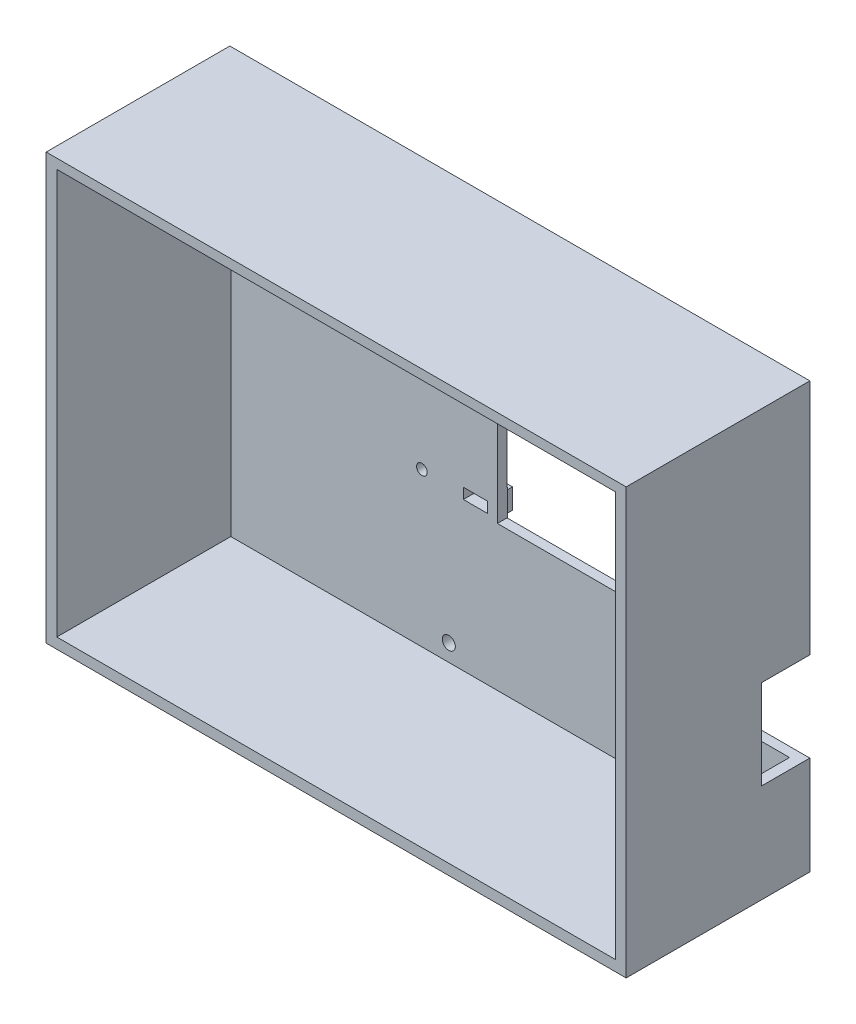
from build123d import *

# Parameters (mm, degrees)
SKETCH_1_W          = 120
SKETCH_1_H          = 80
EXTRUDE_1_DEPTH     = 38
SKETCH_3_W          = 117.6
SKETCH_3_H          = 77.6
CUT_EXTRUDE_1_DEPTH = 36
SKETCH_4_W          = 25.152970524
SKETCH_4_H          = 18.492901276
CUT_EXTRUDE_2_DEPTH = 10
SKETCH_7_W          = 17.413678367
SKETCH_7_H          = 5.076618726
SKETCH_7_H_2        = 5.541721388
EXTRUDE_2_DEPTH     = 0.1
SKETCH_9_W          = 27.882777132
SKETCH_9_H          = 24.878568111
CUT_EXTRUDE_4_DEPTH = 12
SKETCH_12_R         = 1.085209003
SKETCH_12_R_2       = 1.1
SKETCH_12_W         = 5.025
SKETCH_12_H         = 2.2
CUT_EXTRUDE_5_DEPTH = 12
SKETCH_13_R         = 1.35
CUT_EXTRUDE_6_DEPTH = 12
SKETCH_14_W         = 117.6
SKETCH_14_H         = 36
CUT_EXTRUDE_7_DEPTH = 10
EXTRUDE_3_DEPTH     = 5
SKETCH_16_W         = 120
SKETCH_16_H         = 38
EXTRUDE_4_DEPTH     = 2
SKETCH_17_W         = 36
SKETCH_17_H         = 83.8
EXTRUDE_5_DEPTH     = 1
EXTRUDE_6_DEPTH     = 1
SKETCH_19_W         = 120
SKETCH_19_H         = 38
EXTRUDE_7_DEPTH     = 1
EXTRUDE_START       = 2
SKETCH_20_R         = 2
SKETCH_20_R_2       = 1.085209003
SKETCH_20_R_3       = 2.001649737
SKETCH_20_R_4       = 1.1
SKETCH_20_W         = 7.2
SKETCH_20_H         = 4.2
SKETCH_20_W_2       = 5.025
SKETCH_20_H_2       = 2.2
EXTRUDE_8_DEPTH     = 2


with BuildPart() as part:
    # 草图1 → 凸台-拉伸1 (new body)
    with BuildSketch(Plane.XY):
        with Locations((-463.106796117, 303.186737633)):
            Rectangle(SKETCH_1_W, SKETCH_1_H)
    extrude(amount=EXTRUDE_1_DEPTH)

    # 草图3 → 切除-拉伸1 (cut)
    with BuildSketch(Plane.XY.offset(38)):
        with Locations((-463.106796117, 303.186737633)):
            Rectangle(SKETCH_3_W, SKETCH_3_H)
    extrude(amount=-CUT_EXTRUDE_1_DEPTH, mode=Mode.SUBTRACT)

    # 草图4 → 切除-拉伸2 (cut)
    with BuildSketch(Plane(origin=(0, 0, 0), x_dir=(-1, 0, 0), z_dir=(0, 0, -1))):
        with Locations((411.924701676, 291.841861287)):
            Rectangle(SKETCH_4_W, SKETCH_4_H)
    extrude(amount=-CUT_EXTRUDE_2_DEPTH, mode=Mode.SUBTRACT)

    # 草图7 → 凸台-拉伸2 (add)
    with BuildSketch(Plane(origin=(0, 0, 0), x_dir=(-1, 0, 0), z_dir=(0, 0, -1))):
        with Locations((474.461956934, 316.64842827)):
            Rectangle(SKETCH_7_W, SKETCH_7_H)
        with Locations((474.461956934, 296.957598327)):
            Rectangle(SKETCH_7_W, SKETCH_7_H_2)
    extrude(amount=EXTRUDE_2_DEPTH)

    # 草图9 → 切除-拉伸4 (cut)
    with BuildSketch(Plane(origin=(0, 0, 0), x_dir=(-1, 0, 0), z_dir=(0, 0, -1))):
        with Locations((451.813729184, 306.747453577)):
            Rectangle(SKETCH_9_W, SKETCH_9_H)
    extrude(amount=-CUT_EXTRUDE_4_DEPTH, mode=Mode.SUBTRACT)

    # 草图12 → 切除-拉伸5 (cut)
    with BuildSketch(Plane(origin=(0, 0, -0.1), x_dir=(-1, 0, 0), z_dir=(0, 0, -1))):
        with Locations((481.368796117, 317.386737633)):
            Circle(SKETCH_12_R)
        with Locations((481.368796117, 296.186737633)):
            Circle(SKETCH_12_R_2)
        with Locations((470.281296117, 317.386737633)):
            Rectangle(SKETCH_12_W, SKETCH_12_H)
        with Locations((470.281296117, 296.186737633)):
            Rectangle(SKETCH_12_W, SKETCH_12_H)
    extrude(amount=-CUT_EXTRUDE_5_DEPTH, mode=Mode.SUBTRACT)

    # 草图13 → 切除-拉伸6 (cut)
    with BuildSketch(Plane.XY.offset(2)):
        with Locations((-475.806796117, 316.886737633)):
            Circle(SKETCH_13_R)
        with Locations((-417.806796117, 316.886737633)):
            Circle(SKETCH_13_R)
        with Locations((-417.806796117, 267.886737633)):
            Circle(SKETCH_13_R)
        with Locations((-475.806796117, 267.886737633)):
            Circle(SKETCH_13_R)
    extrude(amount=-CUT_EXTRUDE_6_DEPTH, mode=Mode.SUBTRACT)

    # 草图14 → 切除-拉伸7 (cut)
    with BuildSketch(Plane.XZ.offset(-341.986737633)):
        with Locations((-463.106796117, 20)):
            Rectangle(SKETCH_14_W, SKETCH_14_H)
    extrude(amount=-CUT_EXTRUDE_7_DEPTH, mode=Mode.SUBTRACT)

    # 草图15 → 凸台-拉伸3 (add)
    with BuildSketch(Plane(origin=(0, 343.186737633, 0), x_dir=(1, 0, 0), z_dir=(0, 1, 0))):
        Polygon((-521.906796117, -2), (-404.306796117, -2), (-404.306796117, -38), (-403.106796117, -38), (-403.106796117, 0), (-523.106796117, 0), (-523.106796117, -38), (-521.906796117, -38), align=None)
    extrude(amount=EXTRUDE_3_DEPTH)

    # 草图16 → 凸台-拉伸4 (add)
    with BuildSketch(Plane(origin=(0, 348.186737633, 0), x_dir=(1, 0, 0), z_dir=(0, 1, 0))):
        with Locations((-463.106796117, -19)):
            Rectangle(SKETCH_16_W, SKETCH_16_H)
    extrude(amount=EXTRUDE_4_DEPTH)

    # 草图17 → 凸台-拉伸5 (add)
    with BuildSketch(Plane(origin=(-521.906796117, 0, 0), x_dir=(0, 0, -1), z_dir=(1, 0, 0))):
        with Locations((-20, 306.286737633)):
            Rectangle(SKETCH_17_W, SKETCH_17_H)
    extrude(amount=EXTRUDE_5_DEPTH)

    # 草图18 → 凸台-拉伸6 (add)
    with BuildSketch(Plane.ZY.offset(404.306796117)):
        Polygon((10, 301.088311925), (10, 282.595410649), (2, 282.595410649), (2, 264.386737633), (38, 264.386737633), (38, 348.186737633), (2, 348.186737633), (2, 301.088311925), align=None)
    extrude(amount=EXTRUDE_6_DEPTH)

    # 草图19 → 凸台-拉伸7 (add)
    with BuildSketch(Plane.XZ.offset(-263.186737633)):
        with Locations((-463.106796117, 19)):
            Rectangle(SKETCH_19_W, SKETCH_19_H)
    extrude(amount=EXTRUDE_7_DEPTH)

    # 草图20 → 凸台-拉伸8 (add)
    # profile 1 of 4: a face of its own
    with BuildSketch(Plane(origin=(0, 0, -0.1), x_dir=(-1, 0, 0), z_dir=(0, 0, -1)).offset(EXTRUDE_START)):
        with Locations(Location((481.368796117, 317.386737633, 0), (0, 0, 115.841932763))):
            Circle(SKETCH_20_R)
        with Locations((481.368796117, 317.386737633)):
            Circle(SKETCH_20_R_2, mode=Mode.SUBTRACT)
    # profile 2 of 4: a face of its own
    with BuildSketch(Plane(origin=(0, 0, -0.1), x_dir=(-1, 0, 0), z_dir=(0, 0, -1)).offset(EXTRUDE_START)):
        with Locations(Location((481.368796117, 296.186737633, 0), (0, 0, 267.673619076))):
            Circle(SKETCH_20_R_3)
        with Locations((481.368796117, 296.186737633)):
            Circle(SKETCH_20_R_4, mode=Mode.SUBTRACT)
    # profile 3 of 4: a face of its own
    with BuildSketch(Plane(origin=(0, 0, -0.1), x_dir=(-1, 0, 0), z_dir=(0, 0, -1)).offset(EXTRUDE_START)):
        with Locations((470.395177276, 317.386737633)):
            Rectangle(SKETCH_20_W, SKETCH_20_H)
        with Locations((470.281296117, 317.386737633)):
            Rectangle(SKETCH_20_W_2, SKETCH_20_H_2, mode=Mode.SUBTRACT)
    # profile 4 of 4: a face of its own
    with BuildSketch(Plane(origin=(0, 0, -0.1), x_dir=(-1, 0, 0), z_dir=(0, 0, -1)).offset(EXTRUDE_START)):
        with Locations((470.325427447, 296.233937818)):
            Rectangle(SKETCH_20_W, SKETCH_20_H)
        with Locations((470.281296117, 296.186737633)):
            Rectangle(SKETCH_20_W_2, SKETCH_20_H_2, mode=Mode.SUBTRACT)
    extrude(amount=-EXTRUDE_8_DEPTH)


solid = part.part
